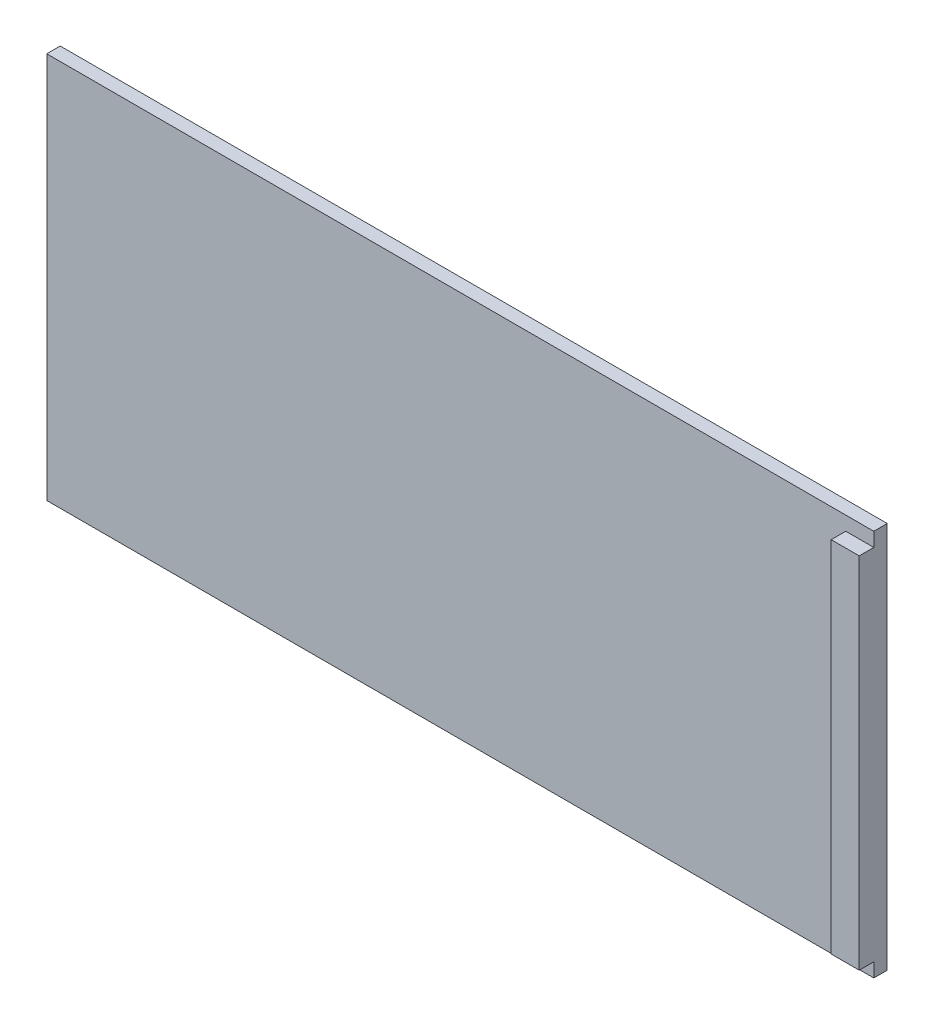
from build123d import *

# Parameters (mm, degrees)
SKETCH1_W           = 74.93
SKETCH1_H           = 35.052
BOSS_EXTRUDE1_DEPTH = 1.2192
SKETCH2_W           = 2.54
SKETCH2_H           = 32.512
BOSS_EXTRUDE2_DEPTH = 1.3208


with BuildPart() as part:
    # Sketch1 → Boss-Extrude1 (new body)
    with BuildSketch(Plane.XY):
        with Locations((37.465, 17.526)):
            Rectangle(SKETCH1_W, SKETCH1_H)
    extrude(amount=BOSS_EXTRUDE1_DEPTH)

    # Sketch2 → Boss-Extrude2 (add)
    with BuildSketch(Plane.XY.offset(1.2192)):
        with Locations((73.66, 17.526)):
            Rectangle(SKETCH2_W, SKETCH2_H)
    extrude(amount=BOSS_EXTRUDE2_DEPTH)


solid = part.part
